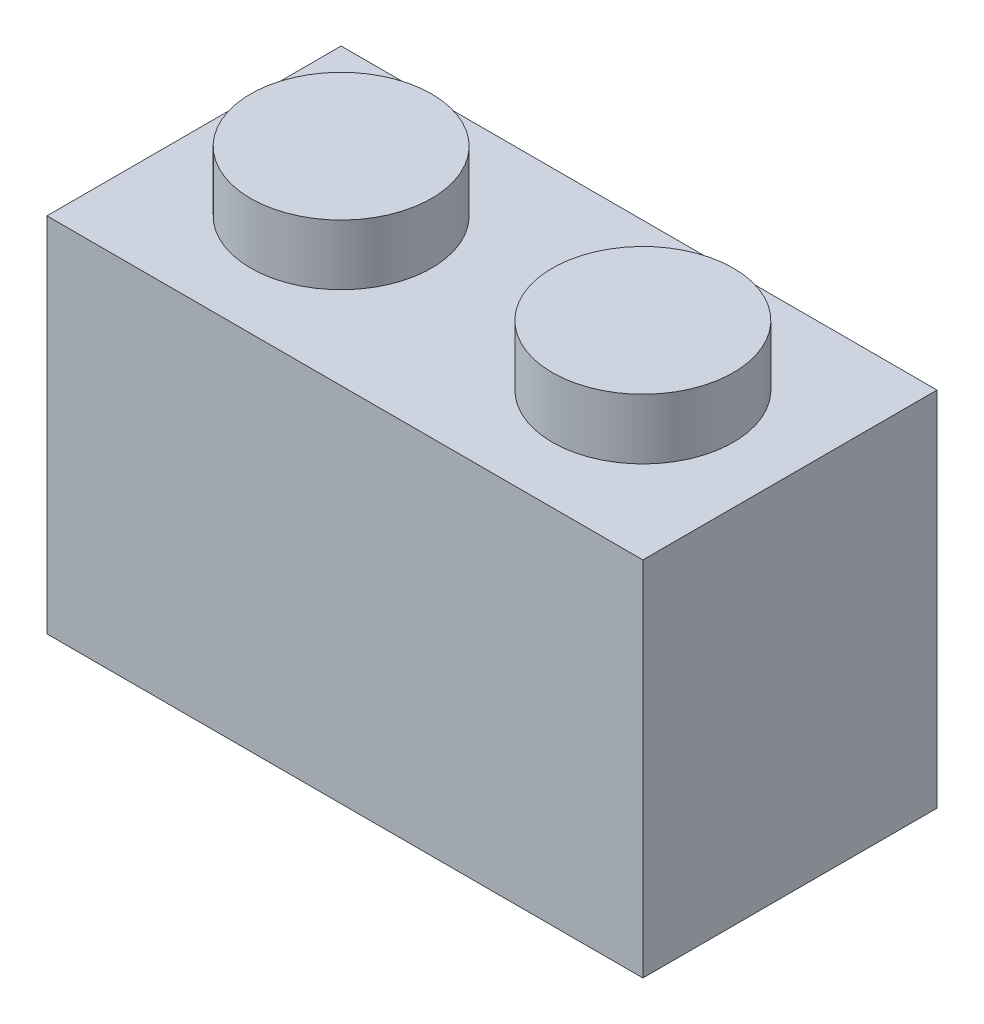
from build123d import *

# Parameters (mm, degrees)
SKETCH1_W            = 15.8
SKETCH1_H            = 9.6
BOSS_EXTRUDE1_DEPTH  = 7.8
SKETCH2_R            = 2.4
BOSS_EXTRUDE2_DEPTH  = 1.6
LPATTERN1_COUNT      = 2
LPATTERN1_PITCH      = 8
LPATTERN1_COUNT_DIR2 = 2
LPATTERN1_PITCH_DIR2 = 8
SHELL1_T             = -1.2
SKETCH3_R            = 1.5
BOSS_EXTRUDE3_DEPTH  = 8.2


with BuildPart() as part:
    # Sketch1 → Boss-Extrude1 (new body)
    with BuildSketch(Plane.XY):
        with Locations((7.9, 4.8)):
            Rectangle(SKETCH1_W, SKETCH1_H)
    extrude(amount=-BOSS_EXTRUDE1_DEPTH)

    # Sketch2 → Boss-Extrude2 (add)
    with BuildSketch(Plane(origin=(0, 9.6, 0), x_dir=(1, 0, 0), z_dir=(0, 1, 0))):
        with Locations(Location((3.9, 3.9, 0), (0, 0, 90))):
            Circle(SKETCH2_R)
    boss_extrude2 = extrude(amount=BOSS_EXTRUDE2_DEPTH)

    # LPattern1: Boss-Extrude2 2 × 2, 2 skipped
    with Locations(*[(i * LPATTERN1_PITCH, 0, j * LPATTERN1_PITCH_DIR2) for i in range(LPATTERN1_COUNT) for j in range(LPATTERN1_COUNT_DIR2) if (i, j) not in ((0, 0), (0, 1), (1, 1))]):
        add(boss_extrude2)

    # Shell1
    shell1_openings = [part.faces().sort_by_distance(p)[0] for p in [
        (7.9, 0, -3.9),
    ]]
    offset(amount=SHELL1_T, openings=shell1_openings, kind=Kind.INTERSECTION)

    # Sketch3 → Boss-Extrude3 (add)
    with BuildSketch(Plane.XZ.offset(-8.4)):
        with Locations(Location((7.9, -3.9, 0), (0, 0, 270))):
            Circle(SKETCH3_R)
    extrude(amount=BOSS_EXTRUDE3_DEPTH)


solid = part.part
